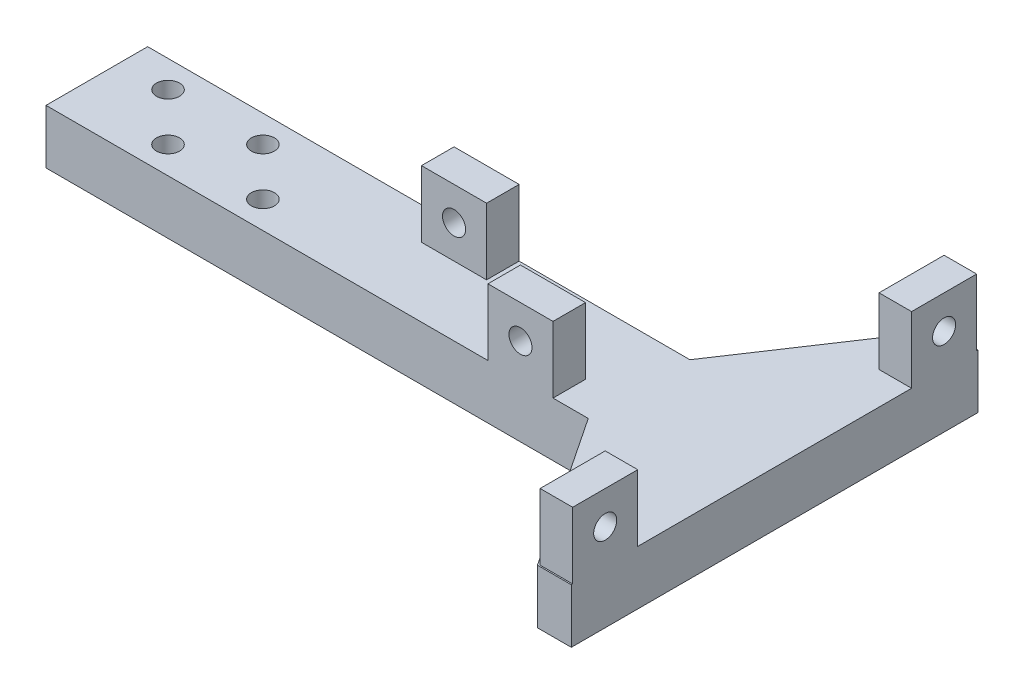
from build123d import *

# Parameters (mm, degrees)
BOSS_EXTRUDE1_DEPTH = 8
SKETCH2_W           = 4.8
SKETCH2_H           = 9.6
SKETCH2_W_2         = 9.6
SKETCH2_H_2         = 4.8
BOSS_EXTRUDE2_DEPTH = 9.8
CUT_EXTRUDE1_REACH  = 103.39
SKETCH3_R           = 1.7
CUT_EXTRUDE2_REACH  = 64.339
SKETCH4_R           = 1.7
CUT_EXTRUDE3_REACH  = 64.339
SKETCH5_R           = 1.7
CUT_EXTRUDE4_START  = -5
CUT_EXTRUDE4_DEPTH  = 3
SKETCH10_R          = 1.7
CUT_EXTRUDE7_DEPTH  = 5
LPATTERN2_COUNT     = 2
LPATTERN2_PITCH     = 14


with BuildPart() as part:
    # Sketch1 → Boss-Extrude1 (new body)
    with BuildSketch(Plane(origin=(0, 0, 0), x_dir=(1, 0, 0), z_dir=(0, 1, 0))):
        Polygon((50, 30), (50, -30), (45, -30), (30, -7.5), (-50, -7.5), (-50, 7.5), (30, 7.5), (45, 30), align=None)
    extrude(amount=BOSS_EXTRUDE1_DEPTH)

    # Sketch2 → Boss-Extrude2 (add)
    with BuildSketch(Plane(origin=(0, 8, 0), x_dir=(1, 0, 0), z_dir=(0, 1, 0))):
        with Locations((47.6, 25)):
            Rectangle(SKETCH2_W, SKETCH2_H)
        with Locations((47.6, -25)):
            Rectangle(SKETCH2_W, SKETCH2_H)
        with Locations((20, -5.1)):
            Rectangle(SKETCH2_W_2, SKETCH2_H_2)
        with Locations((0, 5.1)):
            Rectangle(SKETCH2_W_2, SKETCH2_H_2)
    extrude(amount=BOSS_EXTRUDE2_DEPTH)

    # Sketch3 → Cut-Extrude1 (cut, up to next)
    with BuildSketch(Plane.ZY.offset(-45.2), mode=Mode.PRIVATE) as cut_extrude1_sk1:
        with Locations((-25, 12.9)):
            Circle(SKETCH3_R)
    cut_extrude1_tool1 = extrude(cut_extrude1_sk1.sketch, amount=-CUT_EXTRUDE1_REACH, mode=Mode.PRIVATE) & part.part
    cut_extrude1 = cut_extrude1_tool1.solids().sort_by_distance((45.2, 12.9, -25))[0]
    add(cut_extrude1, mode=Mode.SUBTRACT)

    # Mirror1: Cut-Extrude1 across plane
    add(cut_extrude1.mirror(Plane.XY), mode=Mode.SUBTRACT)

    # Sketch4 → Cut-Extrude2 (cut, up to next)
    with BuildSketch(Plane(origin=(0, 0, 2.7), x_dir=(-1, 0, 0), z_dir=(0, 0, -1)), mode=Mode.PRIVATE) as cut_extrude2_sk1:
        with Locations((-20, 12.9)):
            Circle(SKETCH4_R)
    cut_extrude2_tool1 = extrude(cut_extrude2_sk1.sketch, amount=-CUT_EXTRUDE2_REACH, mode=Mode.PRIVATE) & part.part
    add(cut_extrude2_tool1.solids().sort_by_distance((20, 12.9, 2.7))[0], mode=Mode.SUBTRACT)

    # Sketch5 → Cut-Extrude3 (cut, up to next)
    with BuildSketch(Plane.XY.offset(-2.7), mode=Mode.PRIVATE) as cut_extrude3_sk1:
        with Locations((0, 12.9)):
            Circle(SKETCH5_R)
    cut_extrude3_tool1 = extrude(cut_extrude3_sk1.sketch, amount=-CUT_EXTRUDE3_REACH, mode=Mode.PRIVATE) & part.part
    add(cut_extrude3_tool1.solids().sort_by_distance((0, 12.9, -2.7))[0], mode=Mode.SUBTRACT)

    # Sketch7 → Cut-Extrude4 (cut)
    with BuildSketch(Plane(origin=(0, 8, 0), x_dir=(1, 0, 0), z_dir=(0, 1, 0)).offset(CUT_EXTRUDE4_START)):
        Polygon((-46.5, 3.5), (-44.75, 0.468911087), (-41.25, 0.468911087), (-39.5, 3.5), (-41.25, 6.531088913), (-44.75, 6.531088913), align=None)
        Polygon((-32.5, -3.5), (-34.25, -0.468911087), (-37.75, -0.468911087), (-39.5, -3.5), (-37.75, -6.531088913), (-34.25, -6.531088913), align=None)
    cut_extrude4 = extrude(amount=-CUT_EXTRUDE4_DEPTH, mode=Mode.SUBTRACT)

    # Sketch10 → Cut-Extrude7 (cut)
    with BuildSketch(Plane.XZ.offset(-3)):
        with Locations(Location((-43, -3.5, 0), (0, 0, 270))):
            Circle(SKETCH10_R)
        with Locations(Location((-36, 3.5, 0), (0, 0, 270))):
            Circle(SKETCH10_R)
    cut_extrude7 = extrude(amount=-CUT_EXTRUDE7_DEPTH, mode=Mode.SUBTRACT)

    # LPattern2: Cut-Extrude4, Cut-Extrude7 ×2
    with Locations(*[(i * LPATTERN2_PITCH, 0, 0) for i in range(1, LPATTERN2_COUNT)]):
        add(cut_extrude4, mode=Mode.SUBTRACT)
        add(cut_extrude7, mode=Mode.SUBTRACT)


solid = part.part
